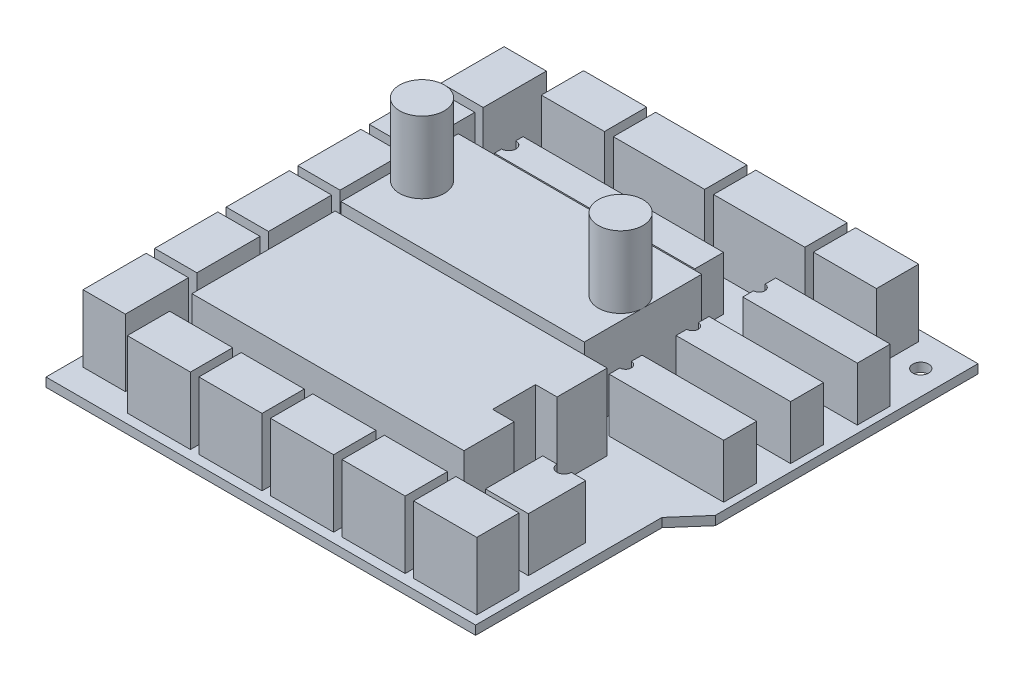
from build123d import *

# Parameters (mm, degrees)
BOSS_EXTRUDE1_DEPTH = 1.5875
SKETCH2_R           = 1.3999972
CUT_EXTRUDE1_DEPTH  = 117.995510328
BOSS_EXTRUDE2_DEPTH = 11.90625
SKETCH4_W           = 43.17991364
SKETCH4_H           = 20.827958344
BOSS_EXTRUDE3_DEPTH = 13.49375
SKETCH6_R           = 3.96875
BOSS_EXTRUDE4_DEPTH = 12.7
BOSS_EXTRUDE5_DEPTH = 9.525


with BuildPart() as part:
    # Sketch1 → Boss-Extrude1 (new body)
    with BuildSketch(Plane(origin=(0, 0, 0), x_dir=(1, 0, 0), z_dir=(0, 1, 0))):
        Polygon((0.038099924, 84.724030552), (0.038099924, 0), (76.258247483, 0), (76.258247483, 33.070733858), (80.667638664, 38.11002378), (80.667638664, 84.724030552), align=None)
    extrude(amount=BOSS_EXTRUDE1_DEPTH)

    # Sketch2 → Cut-Extrude1 (cut, through all)
    with BuildSketch(Plane(origin=(0, 1.5875, 0), x_dir=(1, 0, 0), z_dir=(0, 1, 0))):
        with Locations((76.336947326, 78.897342205)):
            Circle(SKETCH2_R)
        with Locations((26.573446853, 24.724250551)):
            Circle(SKETCH2_R)
    extrude(amount=-CUT_EXTRUDE1_DEPTH, mode=Mode.SUBTRACT)

    # Sketch3 → Boss-Extrude2 (add)
    with BuildSketch(Plane(origin=(0, 1.5875, 0), x_dir=(1, 0, 0), z_dir=(0, 1, 0))):
        Polygon((60.822778354, 75.352649294), (60.822778354, 81.852636294), (60.822778354, 82.852634294), (72.022755954, 82.852634294), (72.022755954, 81.852636294), (72.022755954, 75.352649294), align=None)
        Polygon((59.322781354, 82.852634294), (59.322781354, 81.852636294), (59.322781354, 75.352649294), (43.122813754, 75.352649294), (43.122813754, 81.852636294), (43.122813754, 82.852634294), align=None)
        Polygon((25.342849314, 75.352649294), (25.342849314, 81.852636294), (25.342849314, 82.852634294), (41.542816914, 82.852634294), (41.542816914, 81.852636294), (41.542816914, 75.352649294), align=None)
        Polygon((63.597672804, 1.668196664), (63.597672804, 2.668194664), (63.597672804, 9.168181664), (74.797650404, 9.168181664), (74.797650404, 2.668194664), (74.797650404, 1.668196664), align=None)
        Polygon((50.897698204, 1.668196664), (50.897698204, 2.668194664), (50.897698204, 9.168181664), (62.097675804, 9.168181664), (62.097675804, 2.668194664), (62.097675804, 1.668196664), align=None)
        Polygon((38.197723604, 1.668196664), (38.197723604, 2.668194664), (38.197723604, 9.168181664), (49.397701204, 9.168181664), (49.397701204, 2.668194664), (49.397701204, 1.668196664), align=None)
        Polygon((36.697726604, 9.168181664), (36.697726604, 2.668194664), (36.697726604, 1.668196664), (25.497749004, 1.668196664), (25.497749004, 2.668194664), (25.497749004, 9.168181664), align=None)
        Polygon((12.797774404, 1.668196664), (12.797774404, 2.668194664), (12.797774404, 9.168181664), (23.997752004, 9.168181664), (23.997752004, 2.668194664), (23.997752004, 1.668196664), align=None)
        Polygon((9.318081364, 4.792990414), (2.818094364, 4.792990414), (1.818096364, 4.792990414), (1.818096364, 15.992968014), (2.818094364, 15.992968014), (9.318081364, 15.992968014), align=None)
        Polygon((1.818096364, 28.692942614), (2.818094364, 28.692942614), (9.318081364, 28.692942614), (9.318081364, 17.492965014), (2.818094364, 17.492965014), (1.818096364, 17.492965014), align=None)
        Polygon((9.318081364, 30.192939614), (2.818094364, 30.192939614), (1.818096364, 30.192939614), (1.818096364, 41.392917214), (2.818094364, 41.392917214), (9.318081364, 41.392917214), align=None)
        Polygon((9.318081364, 42.892914214), (2.818094364, 42.892914214), (1.818096364, 42.892914214), (1.818096364, 54.092891814), (2.818094364, 54.092891814), (9.318081364, 54.092891814), align=None)
        Polygon((1.818096364, 66.792866414), (2.818094364, 66.792866414), (9.318081364, 66.792866414), (9.318081364, 55.592888814), (2.818094364, 55.592888814), (1.818096364, 55.592888814), align=None)
        Polygon((12.562874874, 75.352649294), (12.562874874, 81.852636294), (12.562874874, 82.852634294), (23.762852474, 82.852634294), (23.762852474, 81.852636294), (23.762852474, 75.352649294), align=None)
        Polygon((1.818096364, 79.492841014), (2.818094364, 79.492841014), (9.318081364, 79.492841014), (9.318081364, 68.292863414), (2.818094364, 68.292863414), (1.818096364, 68.292863414), align=None)
    extrude(amount=BOSS_EXTRUDE2_DEPTH)

    # Sketch4 → Boss-Extrude3 (add)
    with BuildSketch(Plane(origin=(0, 1.5875, 0), x_dir=(1, 0, 0), z_dir=(0, 1, 0))):
        with Locations((34.317831364, 50.047999904)):
            Rectangle(SKETCH4_W, SKETCH4_H)
        Polygon((13.672772654, 17.343065314), (13.672772654, 32.583034834), (13.672772654, 37.663024674), (61.932676134, 37.663024674), (61.932676134, 28.773042454), (58.122683754, 28.773042454), (58.122683754, 21.153057694), (61.932676134, 21.153057694), (61.932676134, 12.263075474), (13.672772654, 12.263075474), align=None)
    extrude(amount=BOSS_EXTRUDE3_DEPTH)

    # Sketch6 → Boss-Extrude4 (add)
    with BuildSketch(Plane(origin=(0, 15.08125, 0), x_dir=(1, 0, 0), z_dir=(0, 1, 0))):
        with Locations((16.696624544, 50.047999904)):
            Circle(SKETCH6_R)
        with Locations((51.939038184, 50.047999904)):
            Circle(SKETCH6_R)
    extrude(amount=BOSS_EXTRUDE4_DEPTH)

    # Sketch7 → Boss-Extrude5 (add)
    with BuildSketch(Plane(origin=(0, 1.5875, 0), x_dir=(1, 0, 0), z_dir=(0, 1, 0))):
        with BuildLine():
            Line((73.362653274, 22.423055154), (73.362653274, 12.263075474))
            Line((73.362653274, 12.263075474), (65.742668514, 12.263075474))
            Line((65.742668514, 12.263075474), (65.742668514, 22.423055154))
            Line((65.742668514, 22.423055154), (68.282663434, 22.423055154))
            ThreePointArc((68.282663434, 22.423055154), (69.552660894, 21.153057694), (70.822658354, 22.423055154))
            Line((70.822658354, 22.423055154), (73.362653274, 22.423055154))
        make_face()
        with BuildLine():
            Line((79.397641204, 46.710506579), (59.077681844, 46.710506579))
            Line((59.077681844, 46.710506579), (59.077681844, 44.805510389))
            ThreePointArc((59.077681844, 44.805510389), (60.093679812, 43.789512421), (59.077681844, 42.773514453))
            Line((59.077681844, 42.773514453), (59.077681844, 40.868518263))
            Line((59.077681844, 40.868518263), (79.397641204, 40.868518263))
            Line((79.397641204, 40.868518263), (79.397641204, 46.710506579))
        make_face()
        with BuildLine():
            Line((79.397641204, 58.587482825), (59.077681844, 58.587482825))
            Line((59.077681844, 58.587482825), (59.077681844, 56.682486635))
            ThreePointArc((59.077681844, 56.682486635), (60.093679812, 55.666488667), (59.077681844, 54.650490699))
            Line((59.077681844, 54.650490699), (59.077681844, 52.745494509))
            Line((59.077681844, 52.745494509), (79.397641204, 52.745494509))
            Line((79.397641204, 52.745494509), (79.397641204, 58.587482825))
        make_face()
        with BuildLine():
            Line((79.397641204, 70.423859152), (59.077681844, 70.423859152))
            Line((59.077681844, 70.423859152), (59.077681844, 68.518862962))
            ThreePointArc((59.077681844, 68.518862962), (60.093679812, 67.502864994), (59.077681844, 66.486867026))
            Line((59.077681844, 66.486867026), (59.077681844, 64.581870836))
            Line((59.077681844, 64.581870836), (79.397641204, 64.581870836))
            Line((79.397641204, 64.581870836), (79.397641204, 70.423859152))
        make_face()
        with BuildLine():
            Line((14.942770114, 65.917968164), (14.942770114, 64.647970704))
            Line((14.942770114, 64.647970704), (15.06976986, 64.647970704))
            Line((15.06976986, 64.647970704), (50.502698994, 64.647970704))
            Line((50.502698994, 64.647970704), (50.502698994, 69.727960544))
            Line((50.502698994, 69.727960544), (14.942770114, 69.727960544))
            Line((14.942770114, 69.727960544), (14.942770114, 68.457963084))
            ThreePointArc((14.942770114, 68.457963084), (16.212767574, 67.187965624), (14.942770114, 65.917968164))
        make_face()
    extrude(amount=BOSS_EXTRUDE5_DEPTH)


solid = part.part
